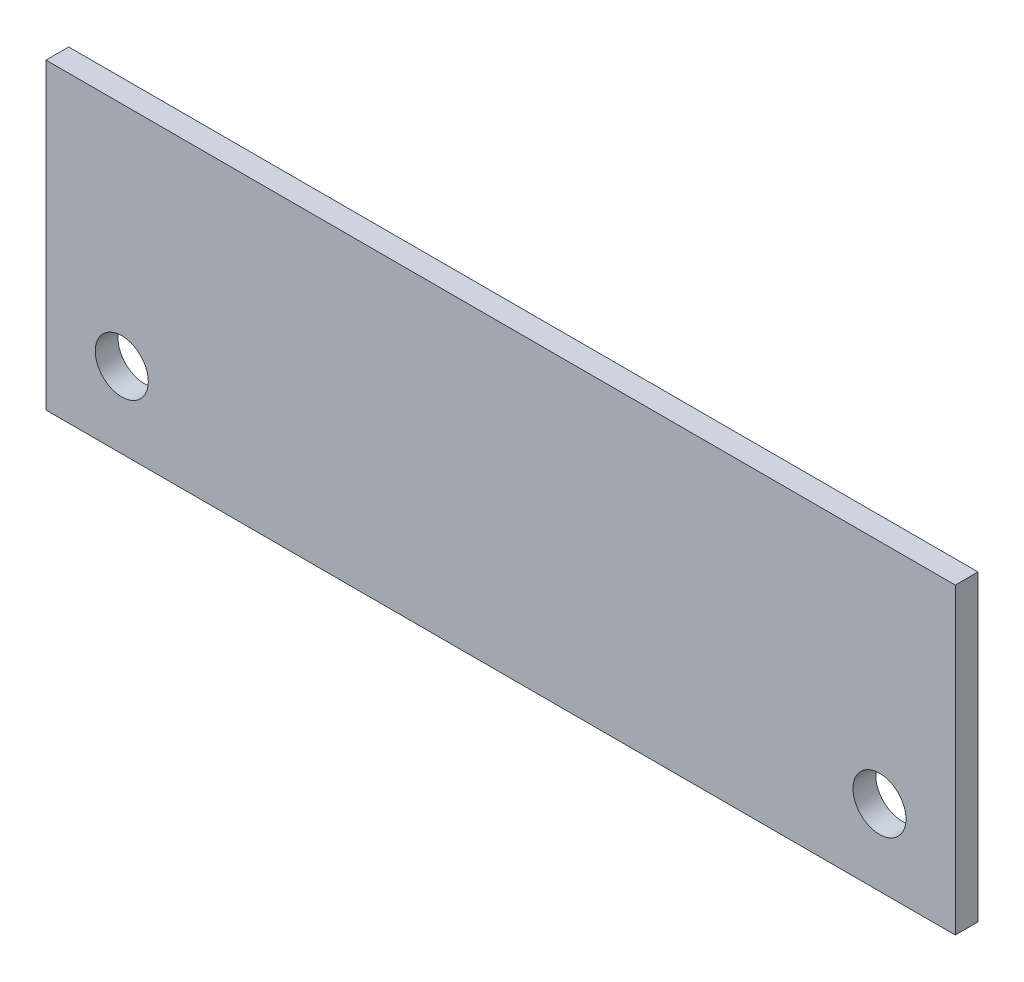
from build123d import *

# Parameters (mm, degrees)
SKETCH1_W           = 240
SKETCH1_H           = 80
SKETCH1_R           = 7
BOSS_EXTRUDE1_DEPTH = 6


with BuildPart() as part:
    # Sketch1 → Boss-Extrude1 (new body)
    with BuildSketch(Plane.XY):
        Rectangle(SKETCH1_W, SKETCH1_H)
        with Locations((-100, -20)):
            Circle(SKETCH1_R, mode=Mode.SUBTRACT)
        with Locations((100, -20)):
            Circle(SKETCH1_R, mode=Mode.SUBTRACT)
    extrude(amount=BOSS_EXTRUDE1_DEPTH)


solid = part.part
